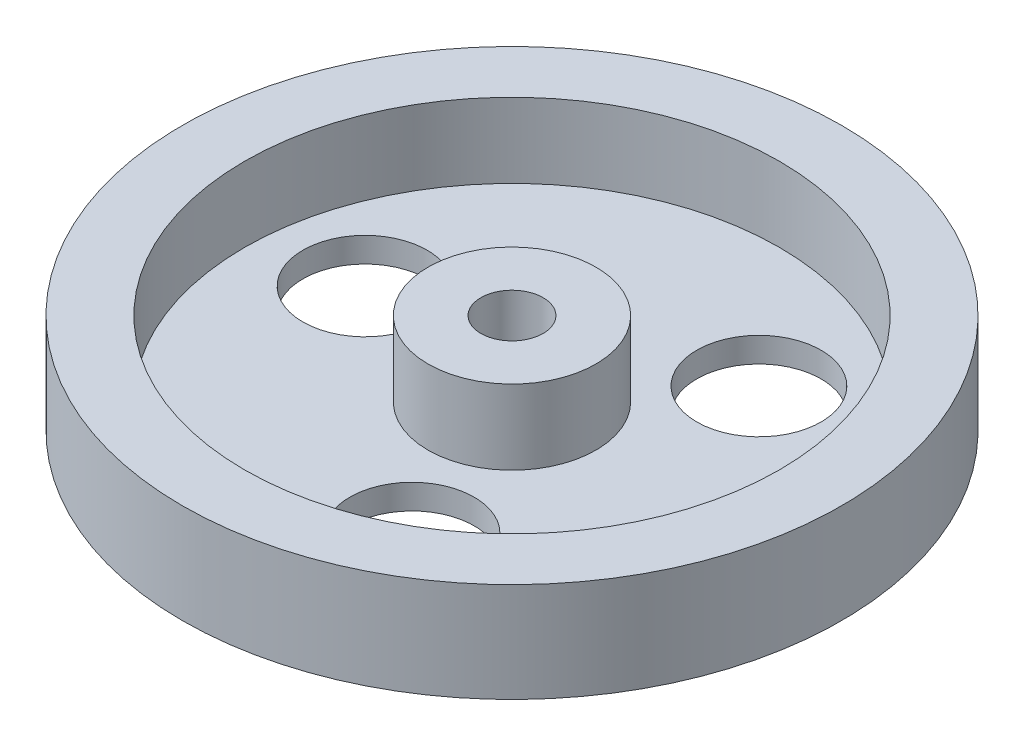
from build123d import *

# Parameters (mm, degrees)
ESQUISSE1_R             = 26.5
BOSS_EXTRU_1_DEPTH      = 8
ESQUISSE2_R             = 21.5
ESQUISSE2_R_2           = 6.75
ENL_V_MAT_EXTRU_1_DEPTH = 6
ESQUISSE3_R             = 2.5
ENL_V_MAT_EXTRU_2_DEPTH = 39.321012513
ESQUISSE4_R             = 5
ENL_V_MAT_EXTRU_3_DEPTH = 38.953919429


with BuildPart() as part:
    # Esquisse1 → Boss.-Extru.1 (new body)
    with BuildSketch(Plane(origin=(0, 0, 0), x_dir=(1, 0, 0), z_dir=(0, 1, 0))):
        with Locations(Location((0, 0, 0), (0, 0, 270))):
            Circle(ESQUISSE1_R)
    extrude(amount=BOSS_EXTRU_1_DEPTH)

    # Esquisse2 → Enlèv. mat.-Extru.1 (cut)
    with BuildSketch(Plane(origin=(0, 8, 0), x_dir=(1, 0, 0), z_dir=(0, 1, 0))):
        with Locations(Location((0, 0, 0), (0, 0, 270))):
            Circle(ESQUISSE2_R)
        with Locations(Location((0, 0, 0), (0, 0, 270))):
            Circle(ESQUISSE2_R_2, mode=Mode.SUBTRACT)
    extrude(amount=-ENL_V_MAT_EXTRU_1_DEPTH, mode=Mode.SUBTRACT)

    # Esquisse3 → Enlèv. mat.-Extru.2 (cut, through all)
    with BuildSketch(Plane(origin=(0, 8, 0), x_dir=(1, 0, 0), z_dir=(0, 1, 0))):
        with Locations(Location((0, 0, 0), (0, 0, 270))):
            Circle(ESQUISSE3_R)
    extrude(amount=-ENL_V_MAT_EXTRU_2_DEPTH, mode=Mode.SUBTRACT)

    # Esquisse4 → Enlèv. mat.-Extru.3 (cut, through all)
    with BuildSketch(Plane(origin=(0, 2, 0), x_dir=(-1, 0, 0), z_dir=(0, 1, 0))):
        with Locations(Location((13.961193072, -2.144927276, 0), (0, 0, 90))):
            Circle(ESQUISSE4_R)
        with Locations(Location((-5.123035026, 13.163211505, 0), (0, 0, 90))):
            Circle(ESQUISSE4_R)
        with Locations(Location((-8.838158046, -11.018284229, 0), (0, 0, 90))):
            Circle(ESQUISSE4_R)
    extrude(amount=-ENL_V_MAT_EXTRU_3_DEPTH, mode=Mode.SUBTRACT)


solid = part.part
